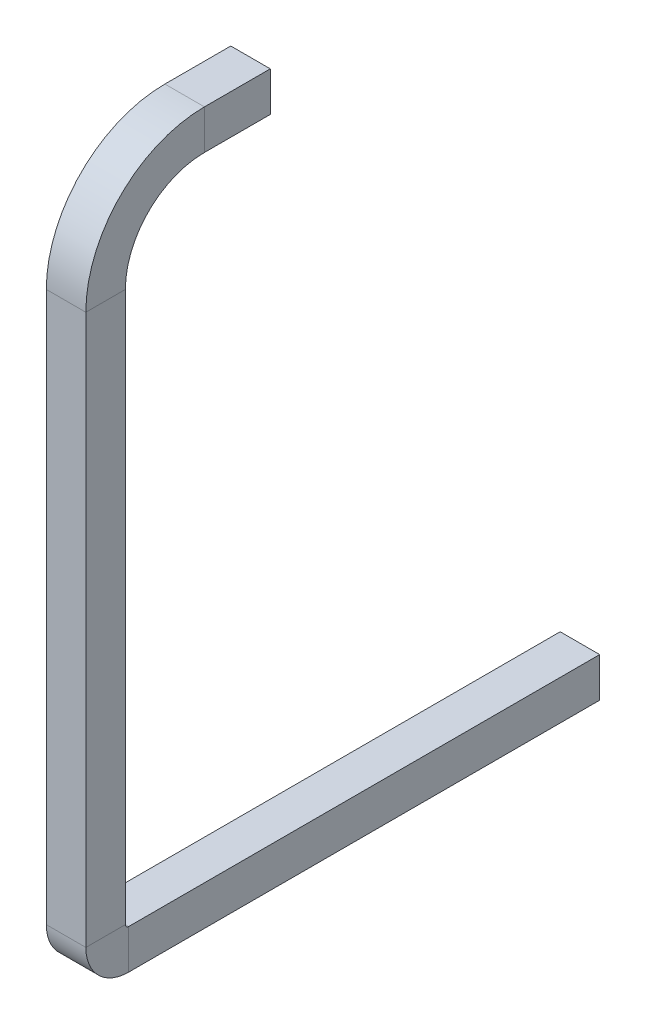
from build123d import *

# Parameters (mm, degrees)
SKETCH2_W = 0.6
SKETCH2_H = 0.6


with BuildPart() as part:
    # Sweep1: sweep along a path in Sketch1
    with BuildLine(Plane(origin=(0, 0, 0), x_dir=(0, 0, -1), z_dir=(1, 0, 0))) as sweep1_path:
        Line((5, -10.2), (-2.15, -10.2))
        ThreePointArc((-2.15, -10.2), (-2.397487373, -10.097487373), (-2.5, -9.85))
        Line((-2.5, -9.85), (-2.5, -1.5))
        ThreePointArc((-2.5, -1.5), (-2.060660172, -0.439339828), (-1, 0))
        Line((-1, 0), (0, 0))
    # Sketch2 → Sweep1 (sweep)
    with BuildSketch(Plane.XY):
        Rectangle(SKETCH2_W, SKETCH2_H)
    sweep(path=sweep1_path.line)


solid = part.part
